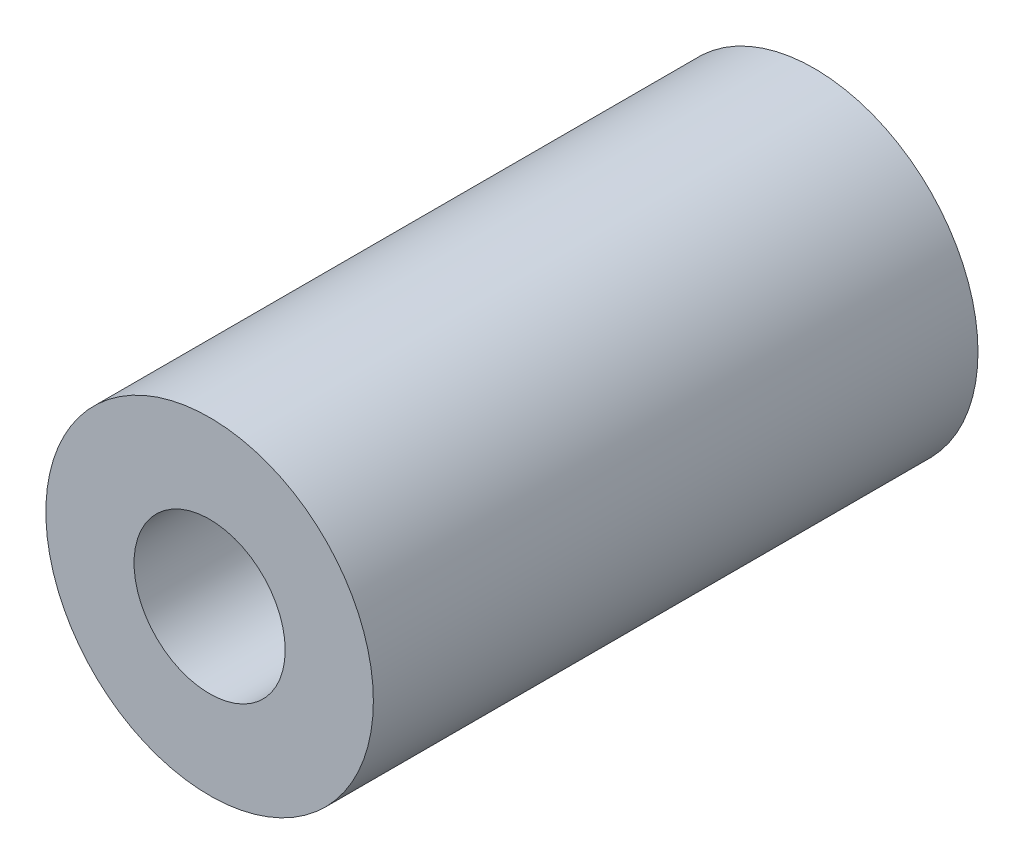
from build123d import *

# Parameters (mm, degrees)
SKETCH_1_R      = 3.25
SKETCH_1_R_2    = 1.5
EXTRUDE_1_DEPTH = 12


with BuildPart() as part:
    # 草图1 → 凸台-拉伸1 (new body)
    with BuildSketch(Plane.XY):
        Circle(SKETCH_1_R)
        Circle(SKETCH_1_R_2, mode=Mode.SUBTRACT)
    extrude(amount=EXTRUDE_1_DEPTH)


solid = part.part
